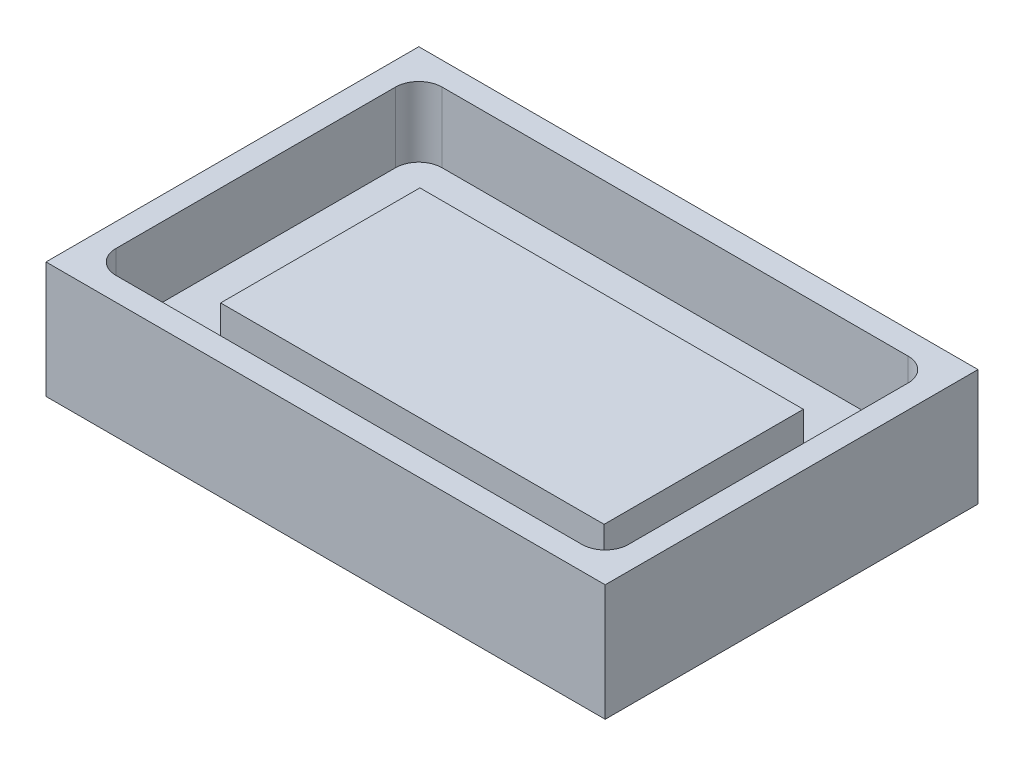
from build123d import *

# Parameters (mm, degrees)
SKETCH4_W      = 76.2
SKETCH4_H      = 50.8
EXTRUDE2_DEPTH = 15.875
EXTRUDE3_DEPTH = 9.525
SKETCH6_W      = 52.256418226
SKETCH6_H      = 27.153557036
EXTRUDE4_DEPTH = 4.7625


with BuildPart() as part:
    # Sketch4 → Extrude2 (new body)
    with BuildSketch(Plane(origin=(0, 0, 0), x_dir=(1, 0, 0), z_dir=(0, 1, 0))):
        with Locations((38.1, 25.4)):
            Rectangle(SKETCH4_W, SKETCH4_H)
    extrude(amount=-EXTRUDE2_DEPTH)

    # Sketch5 → Extrude3 (cut)
    with BuildSketch(Plane(origin=(0, 0, 0), x_dir=(1, 0, 0), z_dir=(0, 1, 0))):
        with BuildLine():
            Line((3.175, 44.45), (3.175, 6.35))
            ThreePointArc((3.175, 6.35), (4.10493597, 4.10493597), (6.35, 3.175))
            Line((6.35, 3.175), (69.85, 3.175))
            ThreePointArc((69.85, 3.175), (72.09506403, 4.10493597), (73.025, 6.35))
            Line((73.025, 6.35), (73.025, 44.45))
            ThreePointArc((73.025, 44.45), (72.09506403, 46.69506403), (69.85, 47.625))
            Line((69.85, 47.625), (6.35, 47.625))
            ThreePointArc((6.35, 47.625), (4.10493597, 46.69506403), (3.175, 44.45))
        make_face()
    extrude(amount=-EXTRUDE3_DEPTH, mode=Mode.SUBTRACT)

    # Sketch6 → Extrude4 (add)
    with BuildSketch(Plane(origin=(0, -9.525, 0), x_dir=(-1, 0, 0), z_dir=(0, 1, 0))):
        with Locations((-38.1, -25.4)):
            Rectangle(SKETCH6_W, SKETCH6_H)
    extrude(amount=EXTRUDE4_DEPTH)


solid = part.part
